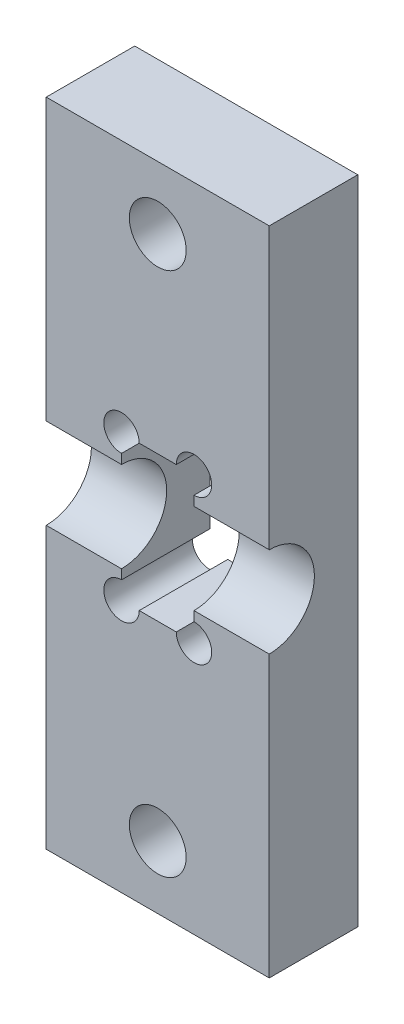
from build123d import *

# Parameters (mm, degrees)
SKETCH1_W           = 20
SKETCH1_H           = 58.42
SKETCH1_R           = 2.55
BOSS_EXTRUDE1_DEPTH = 7.9375
CUT_EXTRUDE1_DEPTH  = 63.256729004


with BuildPart() as part:
    # Sketch1 → Boss-Extrude1 (new body)
    with BuildSketch(Plane.XY):
        with Locations((10, 29.21)):
            Rectangle(SKETCH1_W, SKETCH1_H)
        with Locations((10, 52.78)):
            Circle(SKETCH1_R, mode=Mode.SUBTRACT)
        with Locations((10, 5.64)):
            Circle(SKETCH1_R, mode=Mode.SUBTRACT)
        with BuildLine():
            Line((13.25, 24.2975), (13.25, 34.1225))
            ThreePointArc((13.25, 34.1225), (14.372532015, 36.832532015), (11.6625, 35.71))
            Line((11.6625, 35.71), (8.3375, 35.71))
            ThreePointArc((8.3375, 35.71), (5.627467985, 36.832532015), (6.75, 34.1225))
            Line((6.75, 34.1225), (6.75, 24.2975))
            ThreePointArc((6.75, 24.2975), (5.627467985, 21.587467985), (8.3375, 22.71))
            Line((8.3375, 22.71), (11.6625, 22.71))
            ThreePointArc((11.6625, 22.71), (14.372532015, 21.587467985), (13.25, 24.2975))
        make_face(mode=Mode.SUBTRACT)
    extrude(amount=BOSS_EXTRUDE1_DEPTH)

    # Sketch2 → Cut-Extrude1 (cut, through all)
    with BuildSketch(Plane(origin=(20, 0, 0), x_dir=(0, 0, -1), z_dir=(1, 0, 0))):
        with BuildLine():
            Line((-7.9375, 33.26), (-7.9375, 25.16))
            ThreePointArc((-7.9375, 25.16), (-3.8875, 29.21), (-7.9375, 33.26))
        make_face()
    extrude(amount=-CUT_EXTRUDE1_DEPTH, mode=Mode.SUBTRACT)


solid = part.part
